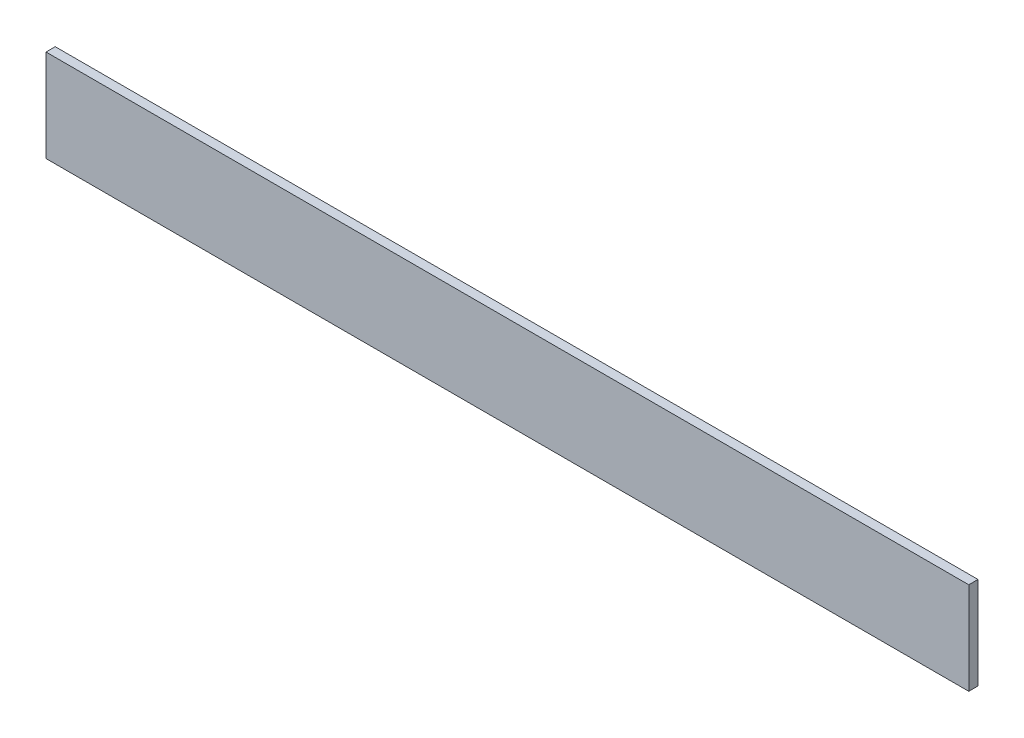
from build123d import *

# Parameters (mm, degrees)
BOSS_EXTRUDE1_DEPTH = 500


with BuildPart() as part:
    # Sketch1 → Boss-Extrude1 (new body)
    with BuildSketch(Plane(origin=(0, 0, 0), x_dir=(0, -1, 0), z_dir=(1, 0, 0))):
        Polygon((5, 0), (55, 0), (55, 5), (25, 5), (15, 5), (5, 5), align=None)
    extrude(amount=BOSS_EXTRUDE1_DEPTH)


solid = part.part
